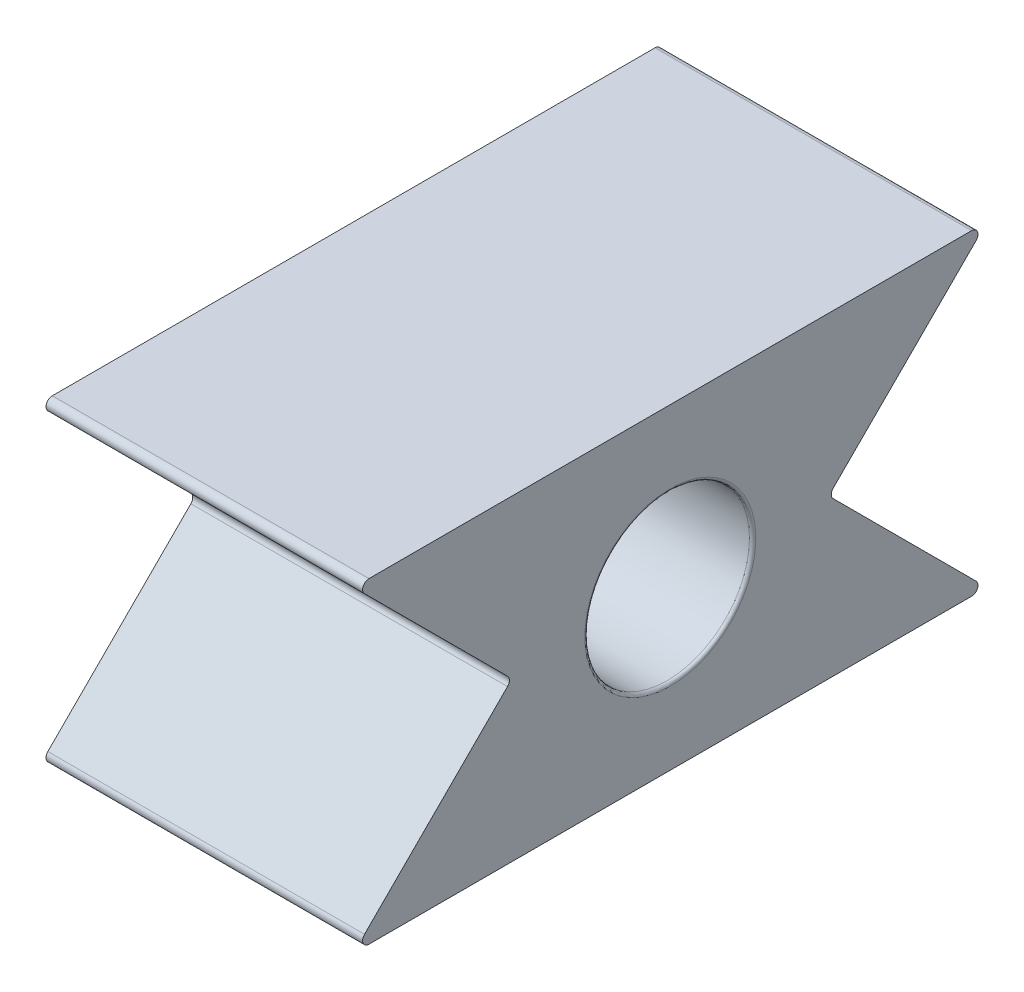
from build123d import *

# Parameters (mm, degrees)
CROQUIS1_R              = 2.6
SALIENTE_EXTRUIR1_DEPTH = 10
REDONDEO1_R             = 0.2
REDONDEO2_R             = 0.1


with BuildPart() as part:
    # Croquis1 → Saliente-Extruir1 (new body)
    with BuildSketch(Plane.YZ):
        Polygon((5, -10), (5, 10), (0, 5.00000025), (-5, 10), (-5, -10), (0, -4.99999975), align=None)
        with Locations(Location((0, 0, 0), (0, 0, 270))):
            Circle(CROQUIS1_R, mode=Mode.SUBTRACT)
    extrude(amount=SALIENTE_EXTRUIR1_DEPTH)

    # Redondeo1
    redondeo1_edges = [part.edges().sort_by_distance(p)[0] for p in [
        (5, 0, -4.99999975),
        (5, -5, -10),
        (5, -5, 10),
        (5, 0, 5.00000025),
        (5, 5, 10),
        (5, 5, -10),
    ]]
    fillet(redondeo1_edges, radius=REDONDEO1_R)

    # Redondeo2
    redondeo2_edges = [part.edges().sort_by_distance(p)[0] for p in [
        (0, 0, 2.6),
        (10, 0, 2.6),
    ]]
    fillet(redondeo2_edges, radius=REDONDEO2_R)


solid = part.part
